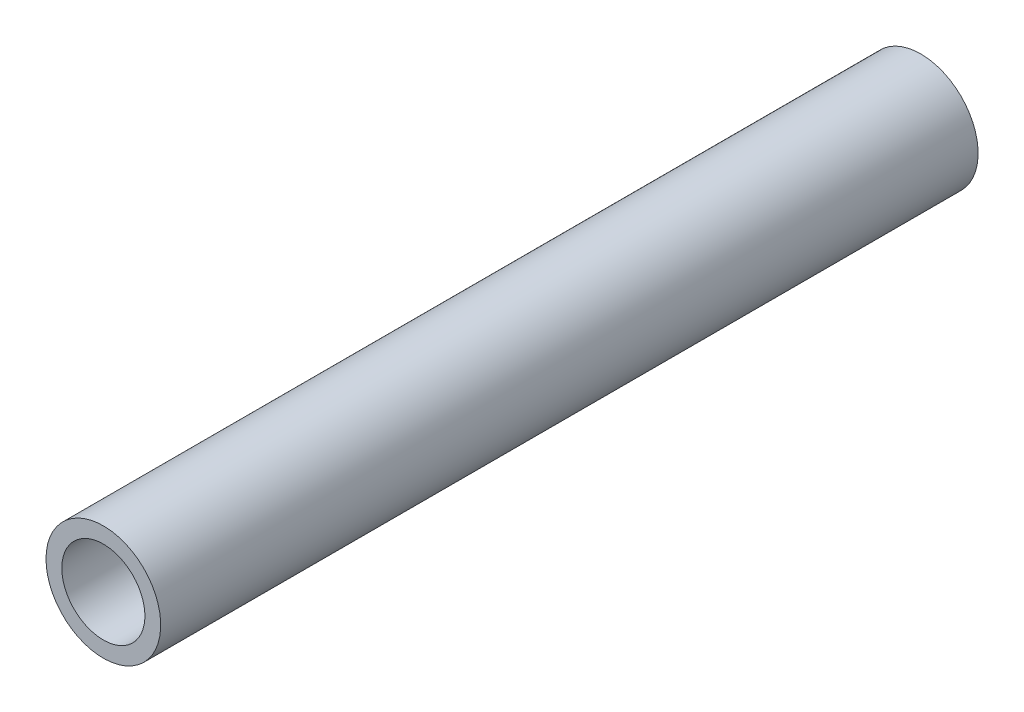
from build123d import *

# Parameters (mm, degrees)
SKETCH1_R           = 10.6934
SKETCH1_R_2         = 7.747
BOSS_EXTRUDE1_DEPTH = 152.4


with BuildPart() as part:
    # Sketch1 → Boss-Extrude1 (new body)
    with BuildSketch(Plane.XY):
        with Locations(Location((0, 0, 0), (0, 0, 180))):
            Circle(SKETCH1_R)
        with Locations(Location((0, 0, 0), (0, 0, 180))):
            Circle(SKETCH1_R_2, mode=Mode.SUBTRACT)
    extrude(amount=BOSS_EXTRUDE1_DEPTH)


solid = part.part
